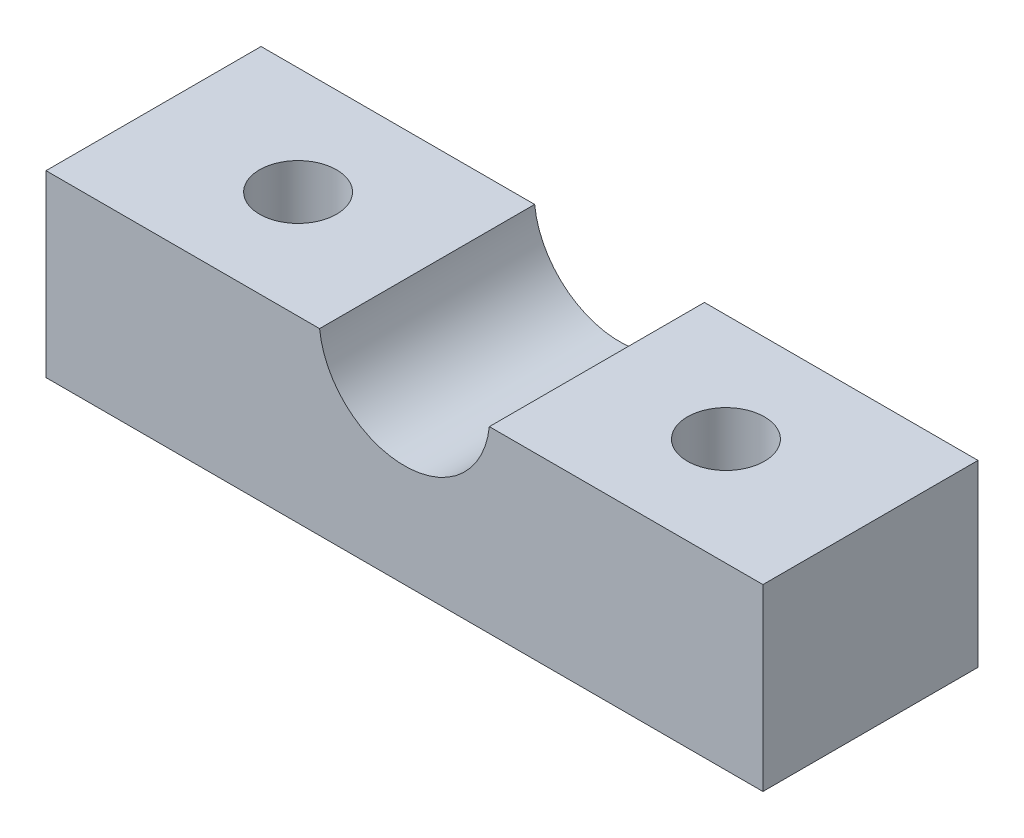
from build123d import *

# Parameters (mm, degrees)
BOSS_EXTRUDE1_DEPTH            = 6
CBORE_FOR_M4_SHCS1_D           = 4.3
CBORE_FOR_M4_SHCS1_CBORE_D     = 8
CBORE_FOR_M4_SHCS1_CBORE_DEPTH = 4


with BuildPart() as part:
    # Sketch1 → Boss-Extrude1 (new, symmetric)
    with BuildSketch(Plane.XY):
        with BuildLine():
            Line((20, 0), (-20, 0))
            Line((-20, 0), (-20, 10))
            Line((-20, 10), (-4.736180555, 10))
            ThreePointArc((-4.736180555, 10), (0, 5.7375), (4.736180555, 10))
            Line((4.736180555, 10), (20, 10))
            Line((20, 10), (20, 0))
        make_face()
    extrude(amount=BOSS_EXTRUDE1_DEPTH, both=True)

    # CBORE for M4 SHCS1 (through all)
    with Locations(Plane.XZ):
        with Locations((-11.9365, 0), (11.9365, 0)):
            CounterBoreHole(CBORE_FOR_M4_SHCS1_D / 2, CBORE_FOR_M4_SHCS1_CBORE_D / 2, CBORE_FOR_M4_SHCS1_CBORE_DEPTH)


solid = part.part
